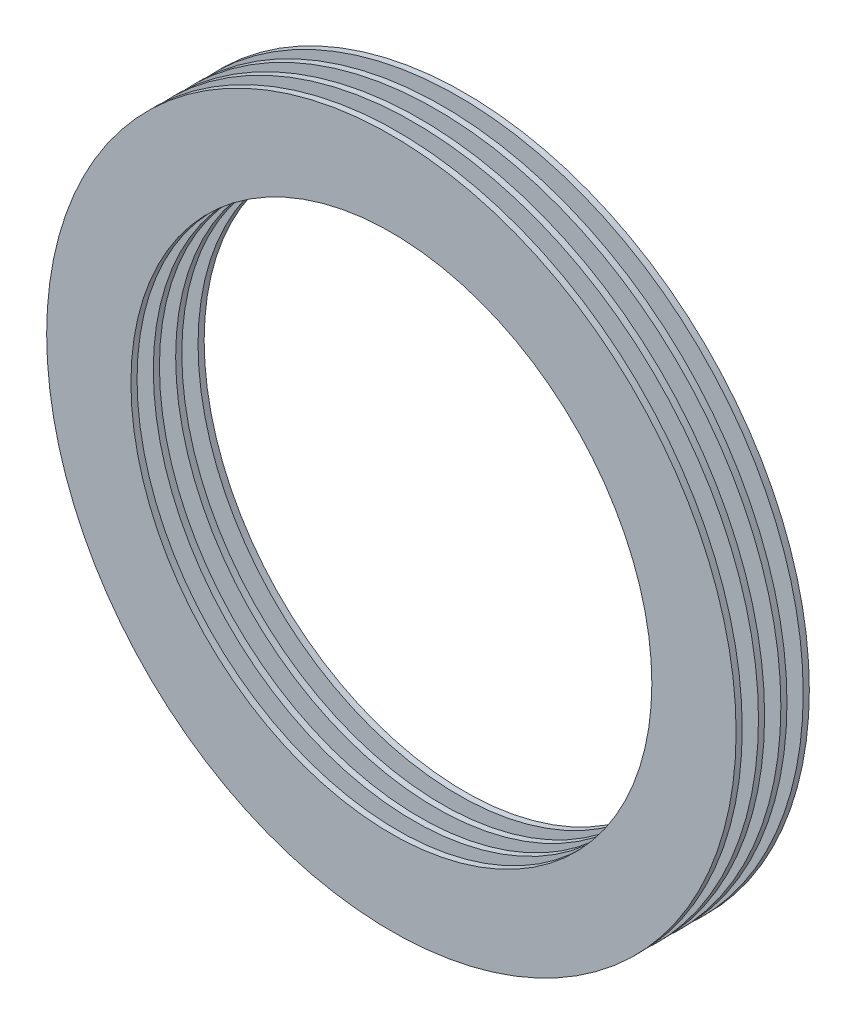
from build123d import *

# Parameters (mm, degrees)
SKETCH1_R          = 14.2875
SKETCH1_R_2        = 10.795
RING_EXTRUDE_DEPTH = 0.254
LPATTERN1_COUNT    = 4
LPATTERN1_PITCH    = 0.9271


with BuildPart() as part:
    # Sketch1 → Ring Extrude (new body)
    with BuildSketch(Plane.XY):
        Circle(SKETCH1_R)
        Circle(SKETCH1_R_2, mode=Mode.SUBTRACT)
    extrude(amount=RING_EXTRUDE_DEPTH)


with BuildPart() as lpattern1_1:
    # LPattern1: pattern copy
    add(part.part.moved(Location(Vector(0, 0, 1) * (1 * LPATTERN1_PITCH))))


with BuildPart() as lpattern1_2:
    # LPattern1: pattern copy
    add(part.part.moved(Location(Vector(0, 0, 1) * (2 * LPATTERN1_PITCH))))


with BuildPart() as lpattern1_3:
    # LPattern1: pattern copy
    add(part.part.moved(Location(Vector(0, 0, 1) * (3 * LPATTERN1_PITCH))))


solid = Compound([part.part, lpattern1_1.part, lpattern1_2.part, lpattern1_3.part])
